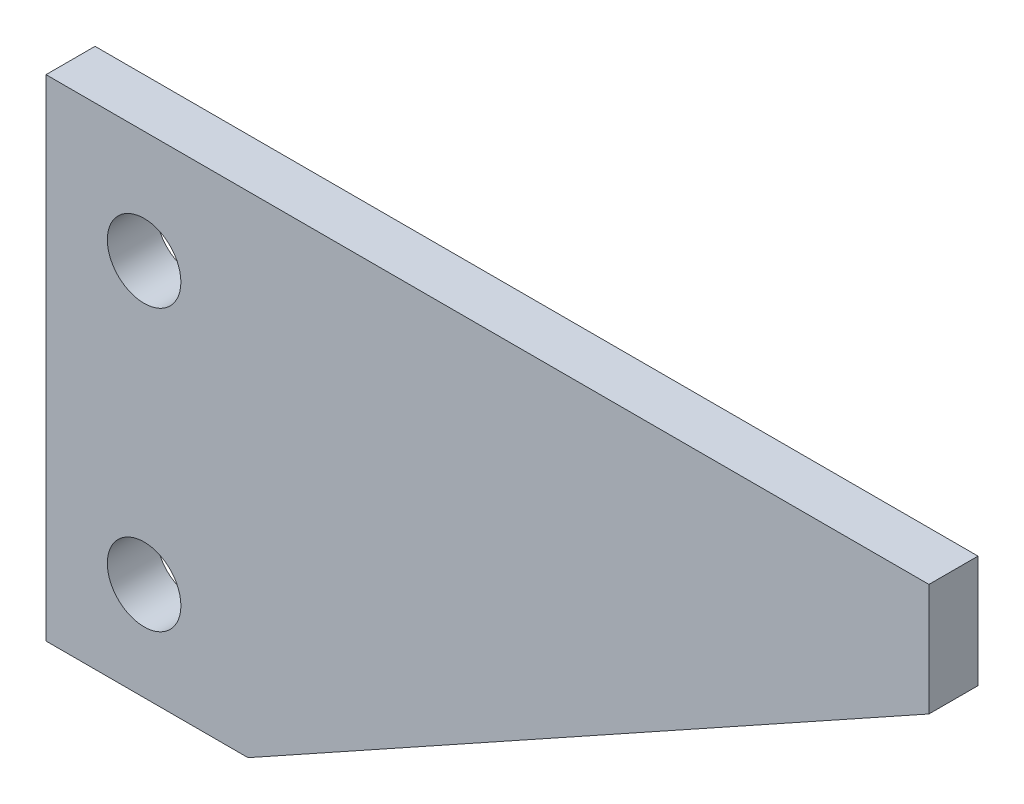
from build123d import *

# Parameters (mm, degrees)
BOSS_EXTRUDE1_DEPTH      = 5
BOSS_EXTRUDE1_DEPTH_BACK = 5
SKETCH1_R                = 7.5


with BuildPart() as part:
    # Sketch1 → Boss-Extrude1 (new, two sides: drawn at the far end of the back side and taken through both)
    with BuildSketch(Plane.XY.offset(-BOSS_EXTRUDE1_DEPTH_BACK)):
        Polygon((-90, -50), (-48.817479436, -50), (90, 27.120821909), (90, 50), (-90, 50), align=None)
        with Locations((-70, 27.120821909)):
            Circle(SKETCH1_R, mode=Mode.SUBTRACT)
        with Locations((-70, -30)):
            Circle(SKETCH1_R, mode=Mode.SUBTRACT)
    extrude(amount=BOSS_EXTRUDE1_DEPTH + BOSS_EXTRUDE1_DEPTH_BACK)


solid = part.part
